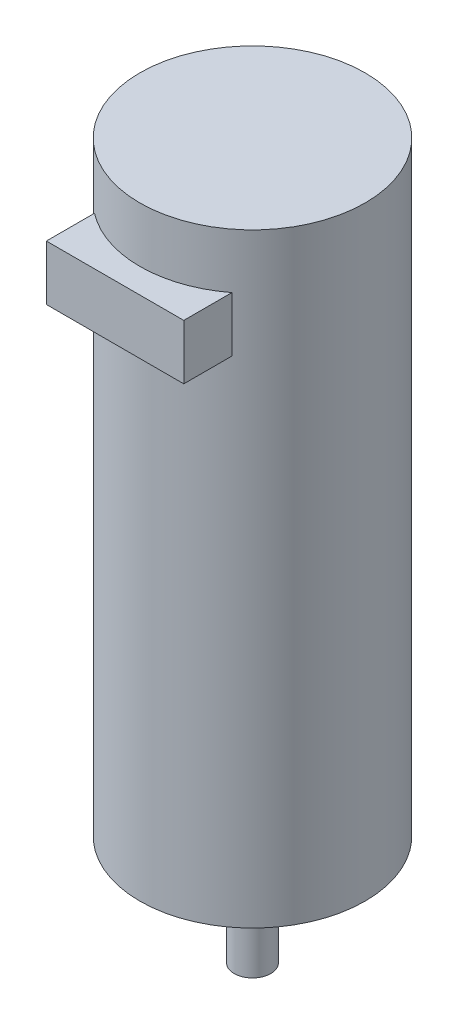
from build123d import *

# Parameters (mm, degrees)
SKETCH_1_R          = 12.3
EXTRUDE_1_DEPTH     = 66
SKETCH_2_W          = 15
SKETCH_2_H          = 6
EXTRUDE_2_DEPTH     = 10
SKETCH_3_R          = 3.5
EXTRUDE_3_DEPTH     = 2.5
SKETCH_4_R          = 2
EXTRUDE_4_DEPTH     = 9.5
SKETCH_5_R          = 1.6
CUT_EXTRUDE_1_DEPTH = 4


with BuildPart() as part:
    # 草图1 → 凸台-拉伸1 (new body)
    with BuildSketch(Plane(origin=(0, 0, 0), x_dir=(1, 0, 0), z_dir=(0, 1, 0))):
        with Locations(Location((0, 0, 0), (0, 0, 270))):
            Circle(SKETCH_1_R)
    extrude(amount=EXTRUDE_1_DEPTH)

    # 草图2 → 凸台-拉伸2 (add)
    with BuildSketch(Plane.XY.offset(5)):
        with Locations((0, 57)):
            Rectangle(SKETCH_2_W, SKETCH_2_H)
    extrude(amount=EXTRUDE_2_DEPTH)

    # 草图3 → 凸台-拉伸3 (add)
    with BuildSketch(Plane.XZ):
        with Locations(Location((0, 0, 0), (0, 0, 270))):
            Circle(SKETCH_3_R)
    extrude(amount=EXTRUDE_3_DEPTH)

    # 草图4 → 凸台-拉伸4 (add)
    with BuildSketch(Plane.XZ.offset(2.5)):
        with Locations(Location((0, 0, 0), (0, 0, 270))):
            Circle(SKETCH_4_R)
    extrude(amount=EXTRUDE_4_DEPTH)

    # 草图5 → 切除-拉伸1 (cut)
    with BuildSketch(Plane.XZ):
        with Locations(Location((0, 8.5, 0), (0, 0, 270))):
            Circle(SKETCH_5_R)
        with Locations(Location((0, -8.5, 0), (0, 0, 270))):
            Circle(SKETCH_5_R)
    extrude(amount=-CUT_EXTRUDE_1_DEPTH, mode=Mode.SUBTRACT)


solid = part.part
